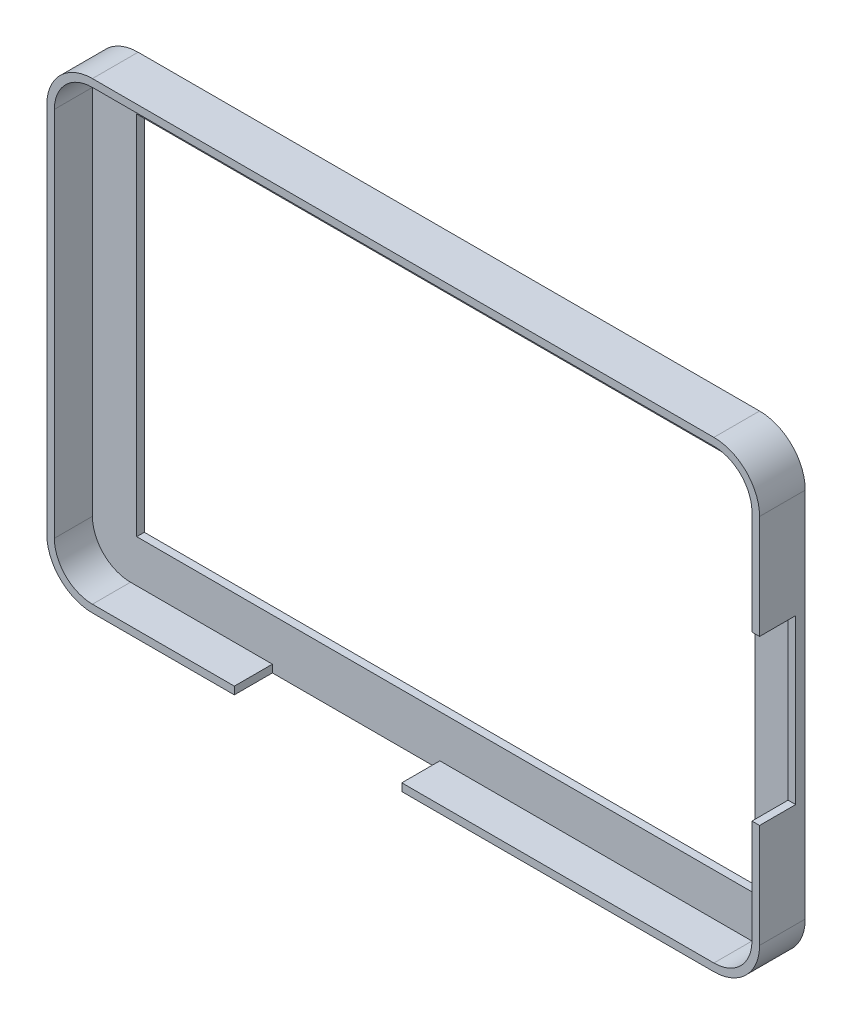
from build123d import *

# Parameters (mm, degrees)
SKIZZE1_W                       = 60.8
SKIZZE1_H                       = 93.64
AUFSATZ_LINEAR_AUSTRAGEN1_DEPTH = 6
VERRUNDUNG1_R                   = 6
WANDUNG1_T                      = -1
SKIZZE2_W                       = 21.5
SKIZZE2_H                       = 9.5
SCHNITT_LINEAR_AUSTRAGEN1_DEPTH = 6
SKIZZE3_W                       = 22
SKIZZE3_H                       = 5
SCHNITT_LINEAR_AUSTRAGEN2_DEPTH = 6
SKIZZE4_W                       = 81.255814336
SKIZZE4_H                       = 48.084928105
SCHNITT_LINEAR_AUSTRAGEN3_DEPTH = 6


with BuildPart() as part:
    # Skizze1 → Aufsatz-Linear austragen1 (new body)
    with BuildSketch(Plane(origin=(0, 0, 0), x_dir=(0, 1, 0), z_dir=(0, 0, 1))):
        Rectangle(SKIZZE1_W, SKIZZE1_H)
    extrude(amount=AUFSATZ_LINEAR_AUSTRAGEN1_DEPTH)

    # Verrundung1
    verrundung1_edges = [part.edges().sort_by_distance(p)[0] for p in [
        (46.82, 30.4, 3),
        (46.82, -30.4, 3),
        (-46.82, -30.4, 3),
        (-46.82, 30.4, 3),
    ]]
    fillet(verrundung1_edges, radius=VERRUNDUNG1_R)

    # Wandung1
    wandung1_openings = [part.faces().sort_by_distance(p)[0] for p in [
        (0, 0, 6),
    ]]
    offset(amount=WANDUNG1_T, openings=wandung1_openings, kind=Kind.INTERSECTION)

    # Skizze2 → Schnitt-Linear austragen1 (cut)
    with BuildSketch(Plane.YZ.offset(46.82)):
        with Locations((0, 6)):
            Rectangle(SKIZZE2_W, SKIZZE2_H)
    extrude(amount=-SCHNITT_LINEAR_AUSTRAGEN1_DEPTH, mode=Mode.SUBTRACT)

    # Skizze3 → Schnitt-Linear austragen2 (cut)
    with BuildSketch(Plane.XZ.offset(30.4)):
        with Locations((-11.18, 3.5)):
            Rectangle(SKIZZE3_W, SKIZZE3_H)
    extrude(amount=-SCHNITT_LINEAR_AUSTRAGEN2_DEPTH, mode=Mode.SUBTRACT)

    # Skizze4 → Schnitt-Linear austragen3 (cut)
    with BuildSketch(Plane(origin=(0, 0, 0), x_dir=(1, 0, 0), z_dir=(0, 0, -1))):
        with Locations((0.624387115, -0.234506354)):
            Rectangle(SKIZZE4_W, SKIZZE4_H)
    extrude(amount=-SCHNITT_LINEAR_AUSTRAGEN3_DEPTH, mode=Mode.SUBTRACT)


solid = part.part
